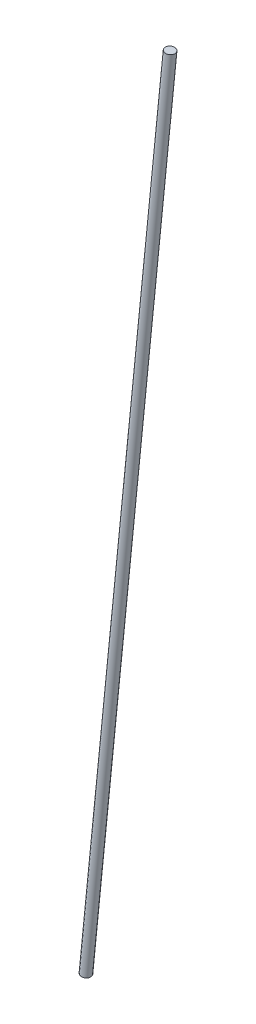
from build123d import *


with BuildPart() as part:
    # 草圖1 → 旋轉1 (revolve)
    with BuildSketch(Plane.XY):
        Polygon((0, 0), (25.99009901, 259.900990099), (27.482654795, 259.75173452), (1.492555785, -0.149255579), align=None)
    revolve(axis=Axis((0, 0, 0), (0.09950371902099855, 0.9950371902099893, 0)))


solid = part.part
